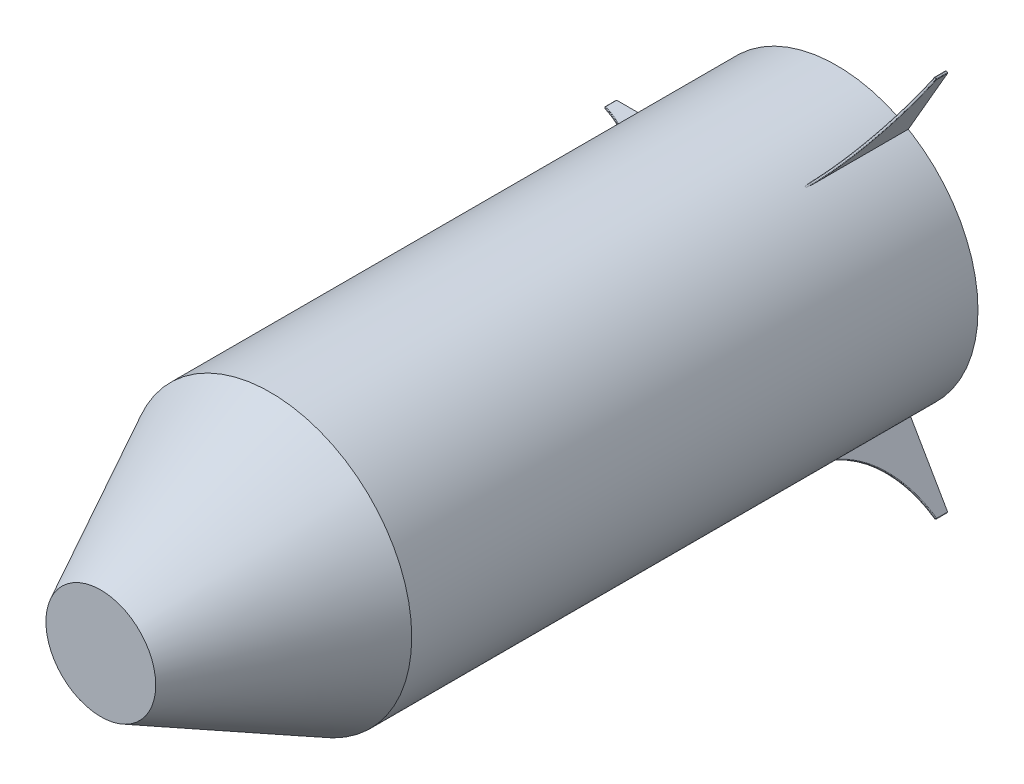
from build123d import *

# Parameters (mm, degrees)
SKETCH1_R                = 3810
BOSS_EXTRUDE1_DEPTH      = 25.4
SKETCH2_R                = 3810
SKETCH2_R_2              = 3803.650001016
BOSS_EXTRUDE2_DEPTH      = 15240
SKETCH3_R                = 3810
BOSS_EXTRUDE4_DEPTH      = 4572
BOSS_EXTRUDE4_TAPER      = 27
SKETCH3_5_R              = 3048
CUT_EXTRUDE2_DEPTH       = 4267.2
CUT_EXTRUDE2_TAPER       = 27
BOSS_EXTRUDE5_DEPTH      = 30.48
BOSS_EXTRUDE5_DEPTH_BACK = 30.48
FILLET1_R                = 15.24
CIRPATTERN1_COUNT        = 3


with BuildPart() as part:
    # Sketch1 → Boss-Extrude1 (new body)
    with BuildSketch(Plane.XY):
        Circle(SKETCH1_R)
    extrude(amount=BOSS_EXTRUDE1_DEPTH)

    # Sketch2 → Boss-Extrude2 (add)
    with BuildSketch(Plane.XY.offset(25.4)):
        Circle(SKETCH2_R)
        Circle(SKETCH2_R_2, mode=Mode.SUBTRACT)
    extrude(amount=BOSS_EXTRUDE2_DEPTH)

    # Sketch3 → Boss-Extrude4 (add)
    with BuildSketch(Plane.XY.offset(15265.4)):
        Circle(SKETCH3_R)
    extrude(amount=BOSS_EXTRUDE4_DEPTH, taper=BOSS_EXTRUDE4_TAPER)

    # Sketch3<5> → Cut-Extrude2 (cut)
    with BuildSketch(Plane.XY.offset(15265.4)):
        Circle(SKETCH3_5_R)
    extrude(amount=CUT_EXTRUDE2_DEPTH, taper=CUT_EXTRUDE2_TAPER, mode=Mode.SUBTRACT)


with BuildPart() as body_2:
    # Sketch4 → Boss-Extrude5 (new, two sides: drawn at the far end of the back side and taken through both)
    with BuildSketch(Plane(origin=(0, 0, 0), x_dir=(1, 0, 0), z_dir=(0, 1, 0)).offset(-BOSS_EXTRUDE5_DEPTH_BACK)):
        with BuildLine():
            Line((-3810, 0), (-5943.6, 0))
            Line((-5943.6, 0), (-5943.6, -304.8))
            add(Edge.make_bspline(
                [(-3810, -2743.2), (-3810, -955.04), (-5943.6, -304.8)],
                knots=[0, 0, 0, 1.198627793, 1.198627793, 1.198627793], degree=2, weights=[1, 0.825722824, 1]))
            Line((-3810, -2743.2), (-3810, 0))
        make_face()
    extrude(amount=BOSS_EXTRUDE5_DEPTH + BOSS_EXTRUDE5_DEPTH_BACK)

    # Fillet1
    fillet1_edges = [body_2.edges().sort_by_distance(p)[0] for p in [
        (-5943.6, -15.24, 304.8),
        (-5943.6, 30.48, 152.4),
        (-5943.6, -30.48, 152.4),
        (-4469.75347539, 30.48, 1183.953636246),
        (-4469.75347539, -30.48, 1183.953636246),
    ]]
    fillet(fillet1_edges, radius=FILLET1_R)


with BuildPart() as cirpattern1_1:
    # CirPattern1: pattern copy
    add(body_2.part.rotate(Axis((0, 0, 0), (0, 0, 1)), 1 * 360 / CIRPATTERN1_COUNT))


with BuildPart() as cirpattern1_2:
    # CirPattern1: pattern copy
    add(body_2.part.rotate(Axis((0, 0, 0), (0, 0, 1)), 2 * 360 / CIRPATTERN1_COUNT))


solid = Compound([part.part, body_2.part, cirpattern1_1.part, cirpattern1_2.part])
